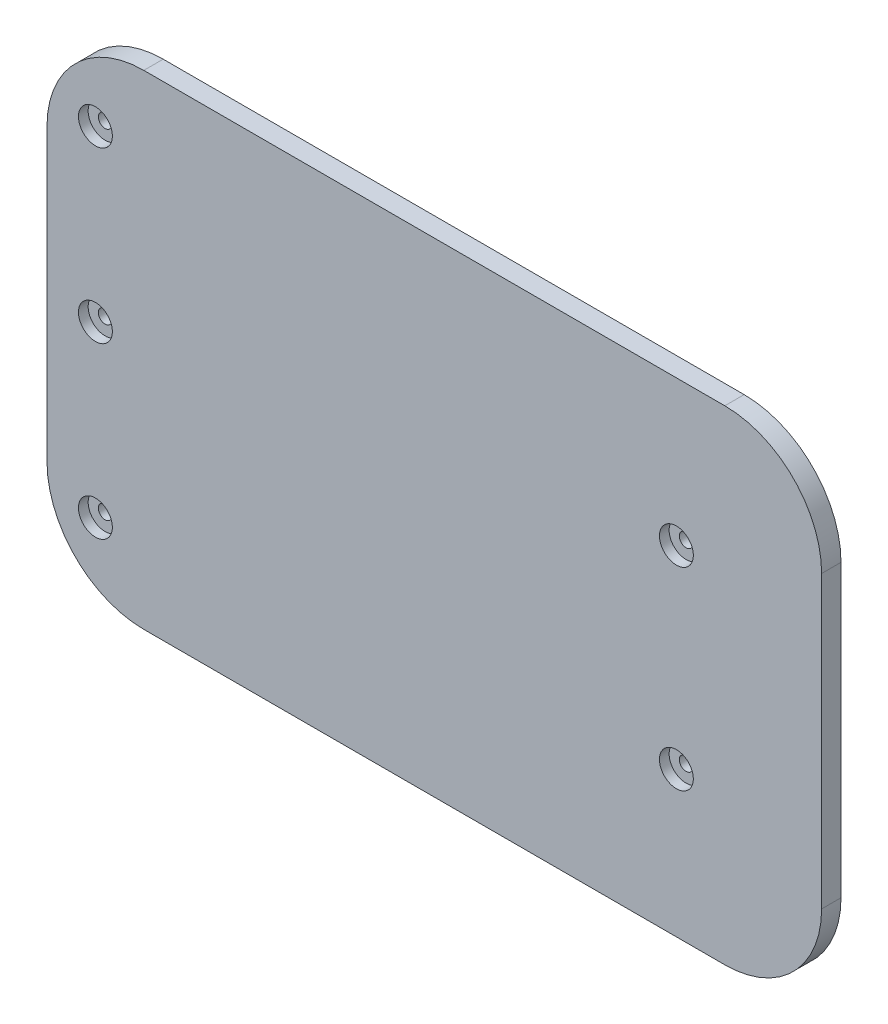
from build123d import *

# Parameters (mm, degrees)
SKETCH1_W           = 160
SKETCH1_H           = 100
BOSS_EXTRUDE1_DEPTH = 4
FILLET1_R           = 20
SKETCH2_R           = 1.4
CUT_EXTRUDE1_DEPTH  = 4
SKETCH3_R           = 3.5
CUT_EXTRUDE2_DEPTH  = 2


with BuildPart() as part:
    # Sketch1 → Boss-Extrude1 (new body)
    with BuildSketch(Plane.XY):
        with Locations((80, 50)):
            Rectangle(SKETCH1_W, SKETCH1_H)
    extrude(amount=BOSS_EXTRUDE1_DEPTH)

    # Fillet1
    fillet1_edges = [part.edges().sort_by_distance(p)[0] for p in [
        (0, 100, 2),
        (160, 100, 2),
        (160, 0, 2),
        (0, 0, 2),
    ]]
    fillet(fillet1_edges, radius=FILLET1_R)

    # Sketch2 → Cut-Extrude1 (cut)
    with BuildSketch(Plane.XY.offset(4)):
        with Locations((130, 30)):
            Circle(SKETCH2_R)
        with Locations((130, 70)):
            Circle(SKETCH2_R)
        with Locations((10, 15)):
            Circle(SKETCH2_R)
        with Locations((10, 50)):
            Circle(SKETCH2_R)
        with Locations((10, 85)):
            Circle(SKETCH2_R)
    extrude(amount=-CUT_EXTRUDE1_DEPTH, mode=Mode.SUBTRACT)

    # Sketch3 → Cut-Extrude2 (cut)
    with BuildSketch(Plane.XY.offset(4)):
        with Locations((130, 30)):
            Circle(SKETCH3_R)
        with Locations((130, 70)):
            Circle(SKETCH3_R)
        with Locations((10, 85)):
            Circle(SKETCH3_R)
        with Locations((10, 50)):
            Circle(SKETCH3_R)
        with Locations((10, 15)):
            Circle(SKETCH3_R)
    extrude(amount=-CUT_EXTRUDE2_DEPTH, mode=Mode.SUBTRACT)


solid = part.part
